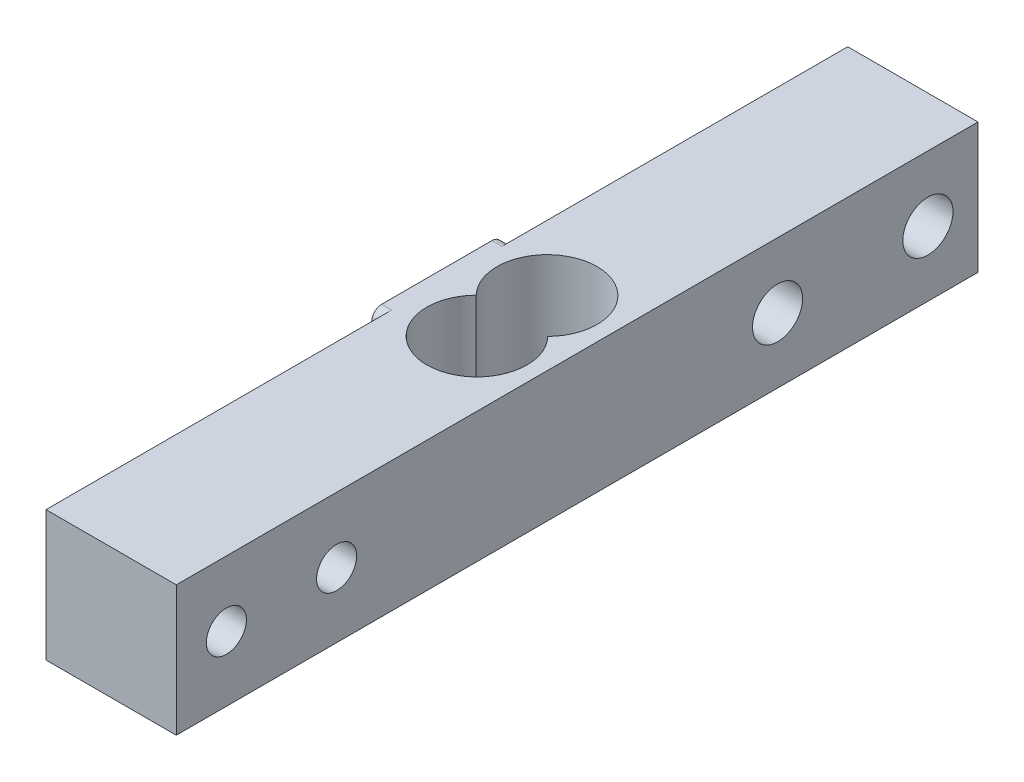
from build123d import *

# Parameters (mm, degrees)
SKETCH1_W           = 13
SKETCH1_H           = 13
BOSS_EXTRUDE1_DEPTH = 40
CUT_EXTRUDE1_DEPTH  = 43.558782877
SKETCH3_R           = 2
SKETCH3_R_2         = 2.5
CUT_EXTRUDE2_DEPTH  = 43.558782877
SKETCH5_W           = 13
SKETCH5_H           = 13
BOSS_EXTRUDE2_DEPTH = 1
FILLET1_R           = 1


with BuildPart() as part:
    # Sketch1 → Boss-Extrude1 (new, symmetric)
    with BuildSketch(Plane.XY):
        Rectangle(SKETCH1_W, SKETCH1_H)
    extrude(amount=BOSS_EXTRUDE1_DEPTH, both=True)

    # Sketch2 → Cut-Extrude1 (cut, through all)
    with BuildSketch(Plane(origin=(0, 6.5, 0), x_dir=(1, 0, 0), z_dir=(0, 1, 0))):
        with BuildLine():
            ThreePointArc((3.570714214, 0), (0, 8.5), (-3.570714214, 0))
            ThreePointArc((-3.570714214, 0), (0, -8.5), (3.570714214, 0))
        make_face()
    extrude(amount=-CUT_EXTRUDE1_DEPTH, mode=Mode.SUBTRACT)

    # Sketch3 → Cut-Extrude2 (cut, through all)
    with BuildSketch(Plane(origin=(6.5, 0, 0), x_dir=(0, 0, -1), z_dir=(1, 0, 0))):
        with Locations((-35, 0)):
            Circle(SKETCH3_R)
        with Locations((-24, 0)):
            Circle(SKETCH3_R)
        with Locations((20, 0)):
            Circle(SKETCH3_R_2)
        with Locations((35, 0)):
            Circle(SKETCH3_R_2)
    extrude(amount=-CUT_EXTRUDE2_DEPTH, mode=Mode.SUBTRACT)

    # Sketch5 → Boss-Extrude2 (add)
    with BuildSketch(Plane.ZY.offset(6.5)):
        Rectangle(SKETCH5_W, SKETCH5_H)
    extrude(amount=BOSS_EXTRUDE2_DEPTH)

    # Fillet1
    fillet1_edges = [part.edges().sort_by_distance(p)[0] for p in [
        (-7, -6.5, 6.5),
        (-7, 6.5, 6.5),
        (-7, 6.5, -6.5),
        (-7, -6.5, -6.5),
    ]]
    fillet(fillet1_edges, radius=FILLET1_R)


solid = part.part
